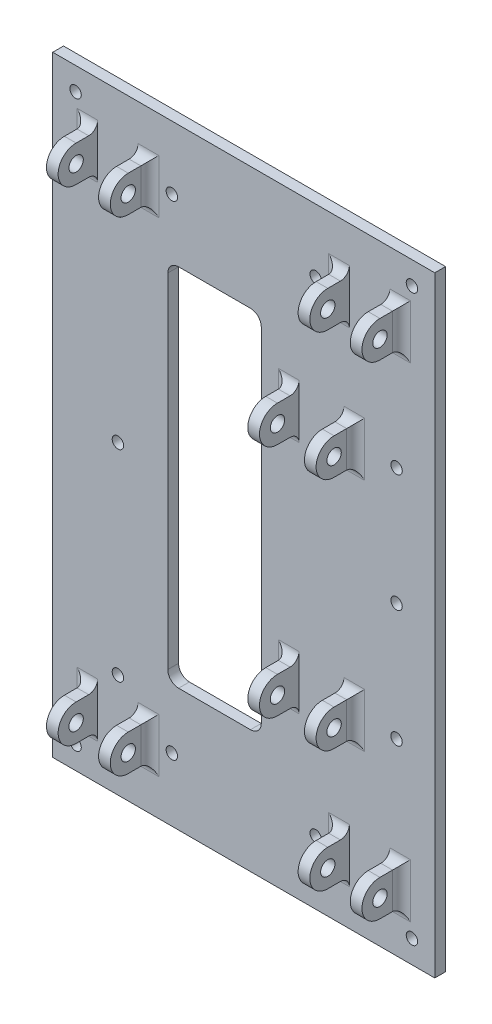
from build123d import *

# Parameters (mm, degrees)
SKETCH1_W               = 212.5
SKETCH1_H               = 339.725
BOSS_EXTRUDE1_DEPTH     = 6
SKETCH2_W               = 6.5
SKETCH2_H               = 20
BOSS_EXTRUDE2_DEPTH     = 24
CUT_EXTRUDE1_DEPTH      = 393.36344838
CUT_EXTRUDE1_DEPTH_BACK = 393.36344838
SKETCH3_R               = 4
FILLET2_R               = 5
SKETCH5_R               = 3.175
CUT_EXTRUDE2_DEPTH      = 402.314497153
CUT_EXTRUDE3_DEPTH      = 402.314497153


with BuildPart() as part:
    # Sketch1 → Boss-Extrude1 (new body)
    with BuildSketch(Plane.XY):
        with Locations((106.25, -169.8625)):
            Rectangle(SKETCH1_W, SKETCH1_H)
    extrude(amount=BOSS_EXTRUDE1_DEPTH)

    # Sketch2 → Boss-Extrude2 (add)
    with BuildSketch(Plane.XY.offset(6)):
        with Locations((21.75, -35.2425)):
            Rectangle(SKETCH2_W, SKETCH2_H)
        with Locations((50.75, -35.2425)):
            Rectangle(SKETCH2_W, SKETCH2_H)
        with Locations((161.75, -35.2425)):
            Rectangle(SKETCH2_W, SKETCH2_H)
        with Locations((190.75, -35.2425)):
            Rectangle(SKETCH2_W, SKETCH2_H)
        with Locations((133.75, -104.5325)):
            Rectangle(SKETCH2_W, SKETCH2_H)
        with Locations((165.25, -104.5325)):
            Rectangle(SKETCH2_W, SKETCH2_H)
        with Locations((165.25, -235.1925)):
            Rectangle(SKETCH2_W, SKETCH2_H)
        with Locations((21.75, -304.4825)):
            Rectangle(SKETCH2_W, SKETCH2_H)
        with Locations((50.75, -304.4825)):
            Rectangle(SKETCH2_W, SKETCH2_H)
        with Locations((190.75, -304.4825)):
            Rectangle(SKETCH2_W, SKETCH2_H)
        with Locations((161.75, -304.4825)):
            Rectangle(SKETCH2_W, SKETCH2_H)
        with Locations((133.75, -235.1925)):
            Rectangle(SKETCH2_W, SKETCH2_H)
    extrude(amount=BOSS_EXTRUDE2_DEPTH)

    # Sketch3 → Cut-Extrude1 (cut, two sides: drawn at the far end of the back side and taken through both)
    with BuildSketch(Plane.ZY.offset(-18.5).offset(-CUT_EXTRUDE1_DEPTH_BACK)):
        with Locations((18, -35.2425)):
            Circle(SKETCH3_R)
        with Locations((18, -235.1925)):
            Circle(SKETCH3_R)
        with Locations((18, -304.4825)):
            Circle(SKETCH3_R)
        with Locations((18, -104.5325)):
            Circle(SKETCH3_R)
        with BuildLine():
            Line((18, -25.2425), (18, -12.982943413))
            Line((18, -12.982943413), (51.949532367, -12.982943413))
            Line((51.949532367, -12.982943413), (51.949532367, -57.481006387))
            Line((51.949532367, -57.481006387), (18, -57.481006387))
            Line((18, -57.481006387), (18, -45.2425))
            ThreePointArc((18, -45.2425), (28, -35.2425), (18, -25.2425))
        make_face()
        with BuildLine():
            Line((52.442304634, -132.399123951), (18, -132.399123951))
            Line((18, -132.399123951), (18, -114.5325))
            ThreePointArc((18, -114.5325), (28, -104.5325), (18, -94.5325))
            Line((18, -94.5325), (18, -71.59149594))
            Line((18, -71.59149594), (52.442304634, -71.59149594))
            Line((52.442304634, -71.59149594), (52.442304634, -132.399123951))
        make_face()
        with BuildLine():
            Line((52.599532243, -270.375386727), (18, -270.375386727))
            Line((18, -270.375386727), (18, -245.1925))
            ThreePointArc((18, -245.1925), (28, -235.1925), (18, -225.1925))
            Line((18, -225.1925), (18, -207.306351849))
            Line((18, -207.306351849), (52.599532243, -207.306351849))
            Line((52.599532243, -207.306351849), (52.599532243, -270.375386727))
        make_face()
        with BuildLine():
            Line((52.621034016, -326.721115515), (18, -326.721115515))
            Line((18, -326.721115515), (18, -314.4825))
            ThreePointArc((18, -314.4825), (28, -304.4825), (18, -294.4825))
            Line((18, -294.4825), (18, -282.222834285))
            Line((18, -282.222834285), (52.621034016, -282.222834285))
            Line((52.621034016, -282.222834285), (52.621034016, -326.721115515))
        make_face()
    extrude(amount=CUT_EXTRUDE1_DEPTH + CUT_EXTRUDE1_DEPTH_BACK, mode=Mode.SUBTRACT)

    # Fillet2
    fillet2_edges = [part.edges().sort_by_distance(p)[0] for p in [
        (158.5, -304.4825, 6),
        (18.5, -304.4825, 6),
        (21.75, -45.2425, 6),
        (18.5, -35.2425, 6),
        (21.75, -25.2425, 6),
        (50.75, -25.2425, 6),
        (50.75, -45.2425, 6),
        (54, -35.2425, 6),
        (161.75, -25.2425, 6),
        (190.75, -25.2425, 6),
        (194, -35.2425, 6),
        (190.75, -45.2425, 6),
        (161.75, -45.2425, 6),
        (158.5, -35.2425, 6),
        (168.5, -104.5325, 6),
        (165.25, -114.5325, 6),
        (133.75, -114.5325, 6),
        (130.5, -104.5325, 6),
        (165.25, -94.5325, 6),
        (133.75, -94.5325, 6),
        (21.75, -294.4825, 6),
        (50.75, -294.4825, 6),
        (54, -304.4825, 6),
        (194, -304.4825, 6),
        (161.75, -294.4825, 6),
        (190.75, -294.4825, 6),
        (190.75, -314.4825, 6),
        (161.75, -314.4825, 6),
        (50.75, -314.4825, 6),
        (21.75, -314.4825, 6),
        (165.25, -225.1925, 6),
        (133.75, -225.1925, 6),
        (130.5, -235.1925, 6),
        (133.75, -245.1925, 6),
        (165.25, -245.1925, 6),
        (168.5, -235.1925, 6),
    ]]
    fillet(fillet2_edges, radius=FILLET2_R)

    # Sketch5 → Cut-Extrude2 (cut, through all)
    with BuildSketch(Plane.XY.offset(6)):
        with Locations((12.7, -12.7)):
            Circle(SKETCH5_R)
        with Locations((199.8, -12.7)):
            Circle(SKETCH5_R)
        with Locations((66.25, -35.2425)):
            Circle(SKETCH5_R)
        with Locations((146.25, -35.2425)):
            Circle(SKETCH5_R)
        with Locations((176.25, -57.8625)):
            Circle(SKETCH5_R)
        with Locations((36.25, -57.8625)):
            Circle(SKETCH5_R)
        with Locations((191.25, -104.5325)):
            Circle(SKETCH5_R)
        with Locations((36.25, -169.8625)):
            Circle(SKETCH5_R)
        with Locations((191.25, -169.8625)):
            Circle(SKETCH5_R)
        with Locations((36.25, -281.8625)):
            Circle(SKETCH5_R)
        with Locations((66.25, -304.4825)):
            Circle(SKETCH5_R)
        with Locations((12.7, -327.025)):
            Circle(SKETCH5_R)
        with Locations((199.8, -327.025)):
            Circle(SKETCH5_R)
        with Locations((146.25, -304.4825)):
            Circle(SKETCH5_R)
        with Locations((191.25, -235.1925)):
            Circle(SKETCH5_R)
    extrude(amount=-CUT_EXTRUDE2_DEPTH, mode=Mode.SUBTRACT)

    # Sketch9 → Cut-Extrude3 (cut, through all)
    with BuildSketch(Plane.XY.offset(6)):
        with BuildLine():
            ThreePointArc((64, -265.3625), (65.757359313, -269.605140687), (70, -271.3625))
            Line((70, -271.3625), (110, -271.3625))
            ThreePointArc((110, -271.3625), (114.242640687, -269.605140687), (116, -265.3625))
            Line((116, -265.3625), (116, -74.3625))
            ThreePointArc((116, -74.3625), (114.242640687, -70.119859313), (110, -68.3625))
            Line((110, -68.3625), (70, -68.3625))
            ThreePointArc((70, -68.3625), (65.757359313, -70.119859313), (64, -74.3625))
            Line((64, -74.3625), (64, -265.3625))
        make_face()
    extrude(amount=-CUT_EXTRUDE3_DEPTH, mode=Mode.SUBTRACT)


solid = part.part
